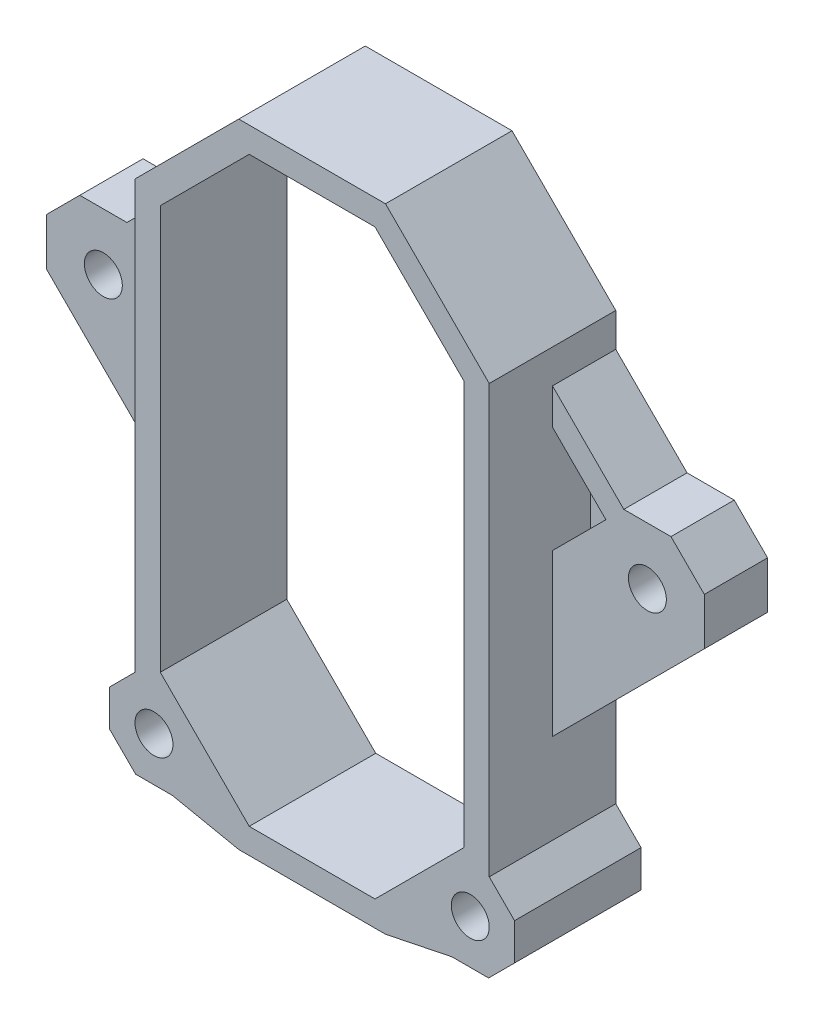
from build123d import *

# Parameters (mm, degrees)
SKETCH2_R           = 1.5
BOSS_EXTRUDE1_DEPTH = 2
SKETCH5_R           = 1.5
BOSS_EXTRUDE4_DEPTH = 3
SKETCH6_R           = 1.5
BOSS_EXTRUDE5_DEPTH = 5


with BuildPart() as part:
    # Sketch2 → Boss-Extrude1 (new body)
    with BuildSketch(Plane.XY):
        Polygon((-26, -1.863961031), (-23.363961031, -4.5), (-14, -13.863961031), (-14, -20.798989873), (-14, -20.970562748), (-16, -22.970562748), (-16, -25.870057685), (-13.949747468, -27.920310217), (-11.050252532, -27.920310217), (-5.798989873, -29), (5.798989873, -29), (11.050252532, -27.920310217), (13.949747468, -27.920310217), (16, -25.870057685), (16, -22.970562748), (14, -20.970562748), (14, -20.798989873), (14, -13.863961031), (23.363961031, -4.5), (26, -1.863961031), (26, 1.863961031), (23.363961031, 4.5), (19.636038969, 4.5), (14, 10.136038969), (14, 12.798989873), (5.798989873, 21), (-5.798989873, 21), (-14, 12.798989873), (-14, 10.136038969), (-19.636038969, 4.5), (-23.363961031, 4.5), (-26, 1.863961031), align=None)
        with Locations((-12.5, -24.420310217)):
            Circle(SKETCH2_R, mode=Mode.SUBTRACT)
        with Locations((12.5, -24.420310217)):
            Circle(SKETCH2_R, mode=Mode.SUBTRACT)
        Polygon((4.970562748, 19), (-4.970562748, 19), (-12, 11.970562748), (-12, 0), (-12, -19.970562748), (-4.970562748, -27), (4.970562748, -27), (12, -19.970562748), (12, 0), (12, 11.970562748), align=None, mode=Mode.SUBTRACT)
    extrude(amount=BOSS_EXTRUDE1_DEPTH)

    # Sketch5 → Boss-Extrude4 (add)
    with BuildSketch(Plane.XY.offset(2)):
        Polygon((-5.798989873, 21), (-14, 12.798989873), (-14, 10.136038969), (-19.636038969, 4.5), (-23.363961031, 4.5), (-26, 1.863961031), (-26, -1.863961031), (-23.363961031, -4.5), (-14, -13.863961031), (-14, -20.798989873), (-14, -20.970562748), (-16, -22.970562748), (-16, -25.870057685), (-13.949747468, -27.920310217), (-11.050252532, -27.920310217), (-5.798989873, -29), (5.798989873, -29), (11.050252532, -27.920310217), (13.949747468, -27.920310217), (16, -25.870057685), (16, -22.970562748), (14, -20.970562748), (14, -20.798989873), (14, -13.863961031), (23.363961031, -4.5), (26, -1.863961031), (26, 1.863961031), (23.363961031, 4.5), (19.636038969, 4.5), (14, 10.136038969), (14, 12.798989873), (5.798989873, 21), align=None)
        with Locations((-21.5, 0)):
            Circle(SKETCH5_R, mode=Mode.SUBTRACT)
        with Locations((21.5, 0)):
            Circle(SKETCH5_R, mode=Mode.SUBTRACT)
        with Locations((-12.5, -24.420310217)):
            Circle(SKETCH5_R, mode=Mode.SUBTRACT)
        with Locations((12.5, -24.420310217)):
            Circle(SKETCH5_R, mode=Mode.SUBTRACT)
        Polygon((-18.221825407, 3.085786438), (-14, 7.307611845), (-14, 0), (-14, -1.136038969), (-17, 1.863961031), align=None, mode=Mode.SUBTRACT)
        Polygon((4.970562748, -27), (-4.970562748, -27), (-12, -19.970562748), (-12, 0), (-12, 11.970562748), (-4.970562748, 19), (4.970562748, 19), (12, 11.970562748), (12, 0), (12, -19.970562748), align=None, mode=Mode.SUBTRACT)
        Polygon((14, -1.136038969), (14, 0), (14, 7.307611845), (18.221825407, 3.085786438), (17, 1.863961031), align=None, mode=Mode.SUBTRACT)
    extrude(amount=BOSS_EXTRUDE4_DEPTH)

    # Sketch6 → Boss-Extrude5 (add)
    with BuildSketch(Plane.XY.offset(5)):
        Polygon((5.798989873, -29), (-5.798989873, -29), (-11.050252532, -27.920310217), (-13.949747468, -27.920310217), (-16, -25.870057685), (-16, -22.970562748), (-14, -20.970562748), (-14, -20.798989873), (-14, 0), (-14, 12.798989873), (-5.798989873, 21), (5.798989873, 21), (14, 12.798989873), (14, 0), (14, -20.798989873), (14, -20.970562748), (16, -22.970562748), (16, -25.870057685), (13.949747468, -27.920310217), (11.050252532, -27.920310217), align=None)
        with Locations((-12.5, -24.420310217)):
            Circle(SKETCH6_R, mode=Mode.SUBTRACT)
        with Locations((12.5, -24.420310217)):
            Circle(SKETCH6_R, mode=Mode.SUBTRACT)
        Polygon((4.970562748, 19), (-4.970562748, 19), (-12, 11.970562748), (-12, 0), (-12, -19.970562748), (-4.970562748, -27), (4.970562748, -27), (12, -19.970562748), (12, 0), (12, 11.970562748), align=None, mode=Mode.SUBTRACT)
    extrude(amount=BOSS_EXTRUDE5_DEPTH)


solid = part.part
